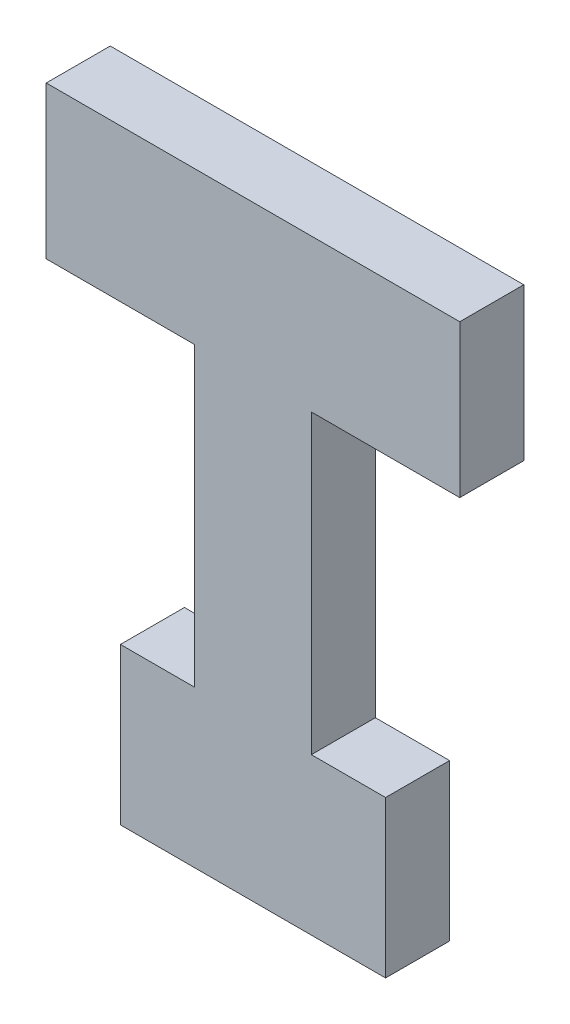
from build123d import *

# Parameters (mm, degrees)
EXTRUDE_1_DEPTH = 10


with BuildPart() as part:
    # Эскиз1 → Бобышка-Вытянуть1 (new body)
    with BuildSketch(Plane.XY):
        Polygon((32.302007209, 41.111645538), (-32.302007209, 41.111645538), (-32.302007209, 17.310166542), (-9.118748446, 17.310166542), (-9.118748446, -29.056350982), (-20.710377827, -29.056350982), (-20.710377827, -53.476050211), (20.710377827, -53.476050211), (20.710377827, -29.056350982), (9.118748446, -29.056350982), (9.118748446, 17.310166542), (32.302007209, 17.310166542), align=None)
    extrude(amount=EXTRUDE_1_DEPTH)


solid = part.part
